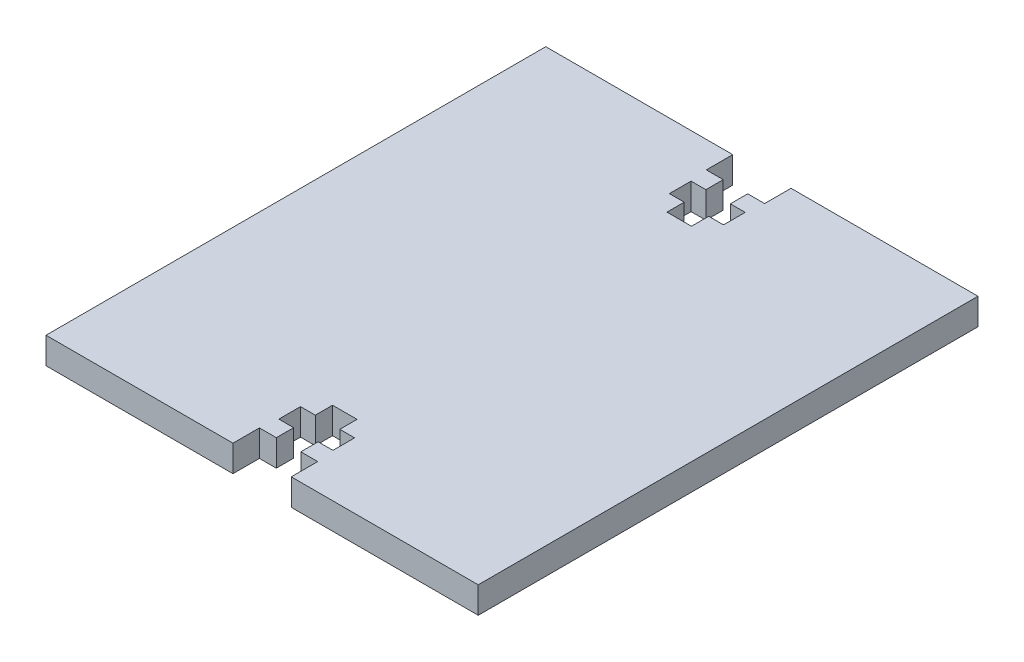
from build123d import *

# Parameters (mm, degrees)
SKETCH1_W           = 51.89
SKETCH1_H           = 60
BOSS_EXTRUDE1_DEPTH = 3.175
CUT_EXTRUDE1_DEPTH  = 10


with BuildPart() as part:
    # Sketch1 → Boss-Extrude1 (new body)
    with BuildSketch(Plane(origin=(0, 0, 0), x_dir=(1, 0, 0), z_dir=(0, 1, 0))):
        Rectangle(SKETCH1_W, SKETCH1_H)
    extrude(amount=BOSS_EXTRUDE1_DEPTH)

    # Sketch2 → Cut-Extrude1 (cut)
    with BuildSketch(Plane(origin=(0, 3.175, 0), x_dir=(1, 0, 0), z_dir=(0, 1, 0))):
        Polygon((-3.5, 30), (3.5, 30), (3.5, 26.825), (1.47, 26.825), (1.47, 24.745), (3.25, 24.745), (3.25, 22.145), (1.47, 22.145), (1.47, 20.075), (-1.47, 20.075), (-1.47, 22.145), (-3.25, 22.145), (-3.25, 24.745), (-1.47, 24.745), (-1.47, 26.825), (-3.5, 26.825), align=None)
        Polygon((1.47, -26.825), (1.47, -24.745), (3.25, -24.745), (3.25, -22.145), (1.47, -22.145), (1.47, -20.075), (-1.47, -20.075), (-1.47, -22.145), (-3.25, -22.145), (-3.25, -24.745), (-1.47, -24.745), (-1.47, -26.825), (-3.5, -26.825), (-3.5, -30), (3.5, -30), (3.5, -26.825), align=None)
    extrude(amount=-CUT_EXTRUDE1_DEPTH, mode=Mode.SUBTRACT)


solid = part.part
